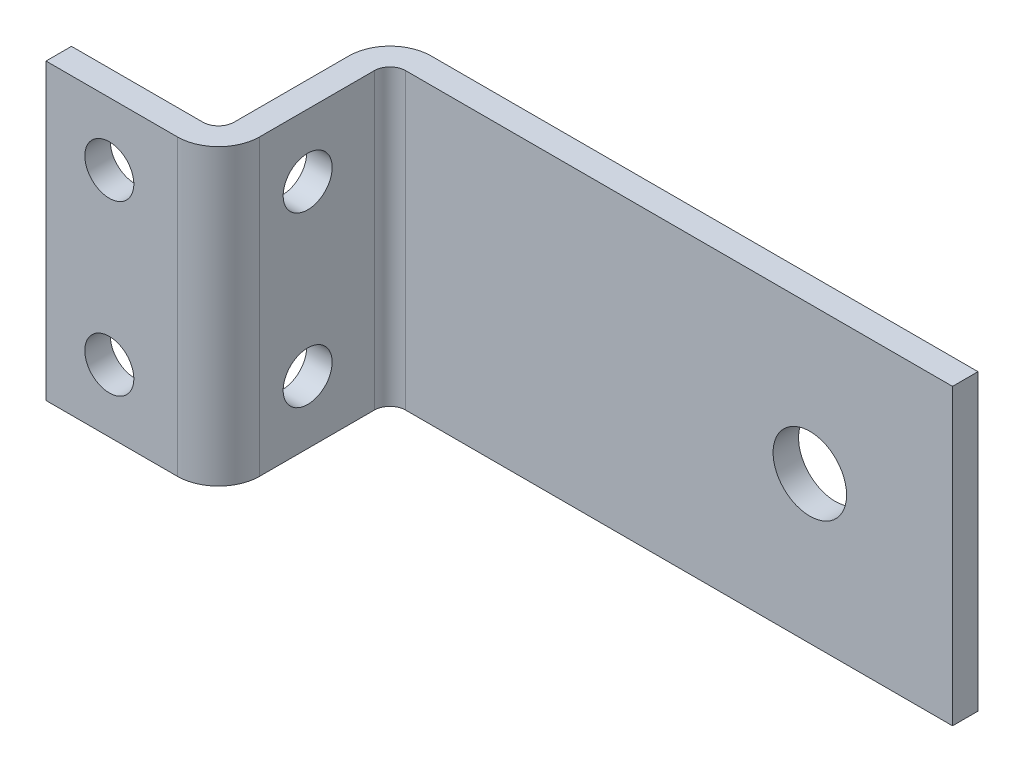
from build123d import *

# Parameters (mm, degrees)
EXTRUDE_THIN1_DEPTH = 19.05
SKETCH4_R           = 3.175
EXTRUDE3_DEPTH      = 104.450523701
SKETCH9_R           = 3.175
CUT_EXTRUDE3_DEPTH  = 80.552804055
SKETCH8_R           = 4.7625
CUT_EXTRUDE2_DEPTH  = 82.628996839


with BuildPart() as part:
    # Sketch1 → Extrude-Thin1 (new, symmetric)
    with BuildSketch(Plane(origin=(0, 0, 0), x_dir=(1, 0, 0), z_dir=(0, 1, 0))):
        with BuildLine():
            Line((-19.05, -22.225), (-2.032, -22.225))
            ThreePointArc((-2.032, -22.225), (-0.595159021, -21.629840979), (0, -20.193))
            Line((0, -20.193), (0, -5.334))
            ThreePointArc((0, -5.334), (1.562292429, -1.562292429), (5.334, 0))
            Line((5.334, 0), (76.2, 0))
            Line((76.2, 0), (76.2, -3.302))
            Line((76.2, -3.302), (5.334, -3.302))
            ThreePointArc((5.334, -3.302), (3.897159021, -3.897159021), (3.302, -5.334))
            Line((3.302, -5.334), (3.302, -20.193))
            ThreePointArc((3.302, -20.193), (1.739707571, -23.964707571), (-2.032, -25.527))
            Line((-2.032, -25.527), (-19.05, -25.527))
            Line((-19.05, -25.527), (-19.05, -22.225))
        make_face()
    extrude(amount=EXTRUDE_THIN1_DEPTH, both=True)

    # Sketch4 → Extrude3 (cut, through all)
    with BuildSketch(Plane(origin=(-22.225, 0, 25.527), x_dir=(-1, 0, 0), z_dir=(0, 0, -1))):
        with Locations((-11.3792, 10.922)):
            Circle(SKETCH4_R)
        with Locations((-11.3792, -10.922)):
            Circle(SKETCH4_R)
    extrude(amount=EXTRUDE3_DEPTH, mode=Mode.SUBTRACT)

    # Sketch9 → Cut-Extrude3 (cut, through all)
    with BuildSketch(Plane(origin=(3.302, 0, 0), x_dir=(0, 0, -1), z_dir=(1, 0, 0))):
        with Locations((-13.97, 10.922)):
            Circle(SKETCH9_R)
        with Locations((-13.97, -10.922)):
            Circle(SKETCH9_R)
    extrude(amount=-CUT_EXTRUDE3_DEPTH, mode=Mode.SUBTRACT)

    # Sketch8 → Cut-Extrude2 (cut, through all)
    with BuildSketch(Plane.XY.offset(3.302)):
        with Locations((57.7088, 0)):
            Circle(SKETCH8_R)
        with Locations((-12.1412, 0)):
            Circle(SKETCH8_R)
    extrude(amount=-CUT_EXTRUDE2_DEPTH, mode=Mode.SUBTRACT)


solid = part.part
